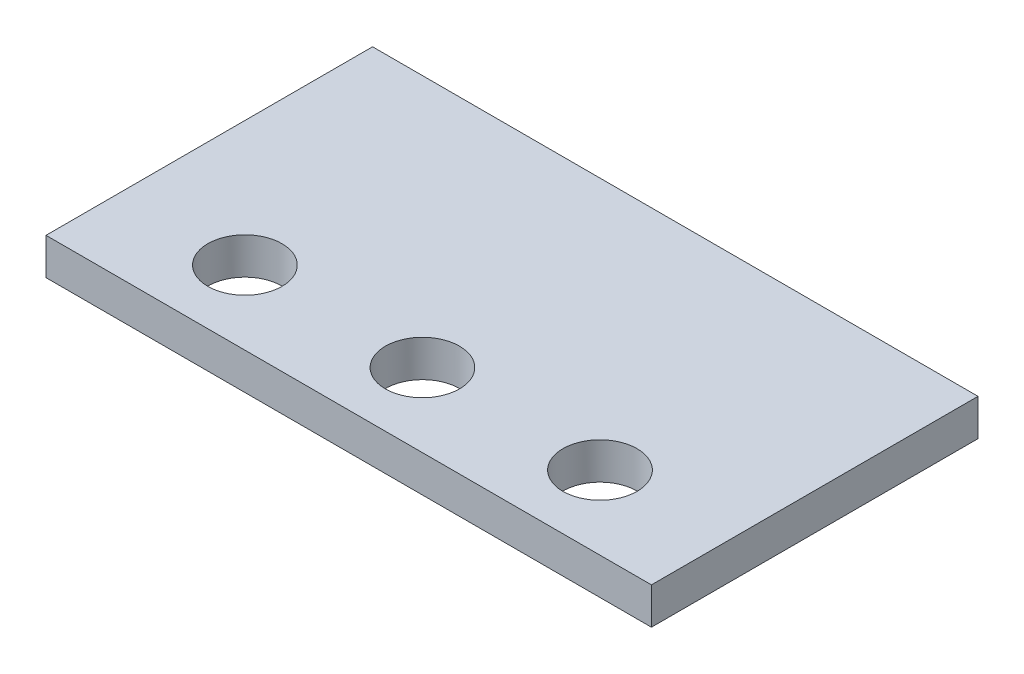
from build123d import *

# Parameters (mm, degrees)
CROQUIS1_W              = 165
CROQUIS1_H              = 20
SALIENTE_EXTRUIR1_DEPTH = 178
CORTAR_EXTRUIR1_REACH   = 401.805
CROQUIS2_R              = 20.190307202


with BuildPart() as part:
    # Croquis1 → Saliente-Extruir1 (new body)
    with BuildSketch(Plane(origin=(0, 0, 360), x_dir=(-1, 0, 0), z_dir=(0, 0, -1))):
        with Locations((-74.745907017, -157.165586138)):
            Rectangle(CROQUIS1_W, CROQUIS1_H)
        with Locations((90.254092983, -157.165586138)):
            Rectangle(CROQUIS1_W, CROQUIS1_H)
    extrude(amount=SALIENTE_EXTRUIR1_DEPTH)

    # Croquis2 → Cortar-Extruir1 (cut, up to next)
    with BuildSketch(Plane.XZ.offset(167.165586138), mode=Mode.PRIVATE) as cortar_extruir1_sk1:
        with Locations((-104.519454625, 319.809692798)):
            Circle(CROQUIS2_R)
    cortar_extruir1_tool1 = extrude(cortar_extruir1_sk1.sketch, amount=-CORTAR_EXTRUIR1_REACH, mode=Mode.PRIVATE) & part.part
    # Croquis2 → Cortar-Extruir1 (cut, up to next)
    with BuildSketch(Plane.XZ.offset(167.165586138), mode=Mode.PRIVATE) as cortar_extruir1_sk2:
        with Locations((-7.754092983, 319.809692798)):
            Circle(CROQUIS2_R)
    cortar_extruir1_tool2 = extrude(cortar_extruir1_sk2.sketch, amount=-CORTAR_EXTRUIR1_REACH, mode=Mode.PRIVATE) & part.part
    # Croquis2 → Cortar-Extruir1 (cut, up to next)
    with BuildSketch(Plane.XZ.offset(167.165586138), mode=Mode.PRIVATE) as cortar_extruir1_sk3:
        with Locations((89.011268658, 319.809692798)):
            Circle(CROQUIS2_R)
    cortar_extruir1_tool3 = extrude(cortar_extruir1_sk3.sketch, amount=-CORTAR_EXTRUIR1_REACH, mode=Mode.PRIVATE) & part.part
    add(cortar_extruir1_tool1.solids().sort_by_distance((-104.519455, -167.165586, 319.809693))[0], mode=Mode.SUBTRACT)
    add(cortar_extruir1_tool2.solids().sort_by_distance((-7.754093, -167.165586, 319.809693))[0], mode=Mode.SUBTRACT)
    add(cortar_extruir1_tool3.solids().sort_by_distance((89.011269, -167.165586, 319.809693))[0], mode=Mode.SUBTRACT)


solid = part.part
